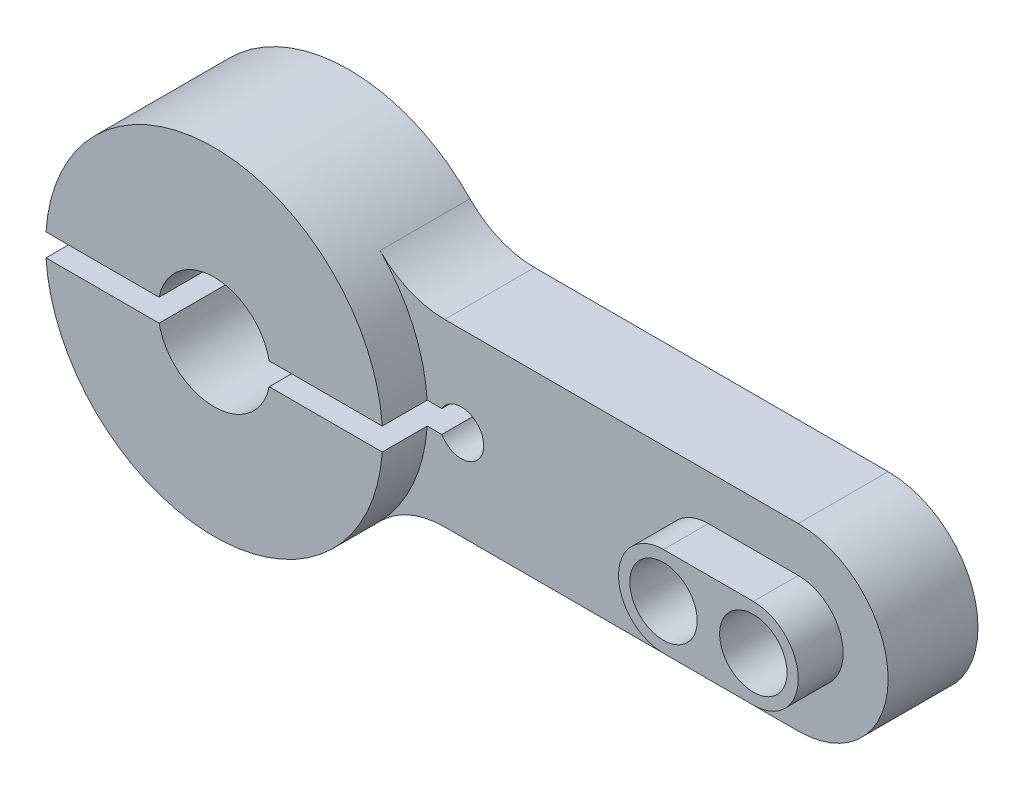
from build123d import *
from build123d.topology import SkipClean

# Parameters (mm, degrees)
BOSS_EXTRUDE1_DEPTH = 6
FILLET1_R           = 4
CUT_EXTRUDE1_DEPTH  = 2
SKETCH3_R           = 1.5
SKETCH3_R_2         = 2.5
CUT_EXTRUDE2_DEPTH  = 30.601520231
CUT_EXTRUDE3_DEPTH  = 30.601520231
BOSS_EXTRUDE2_START = -1.27
BOSS_EXTRUDE2_DEPTH = 1.27


with BuildPart() as part:
    # Sketch1 → Boss-Extrude1 (new body)
    with BuildSketch(Plane.XY):
        with BuildLine():
            Line((6.34428877, 4), (24, 4))
            ThreePointArc((24, 4), (28, 0), (24, -4))
            Line((24, -4), (6.34428877, -4))
            ThreePointArc((6.34428877, -4), (-7.5, 0), (6.34428877, 4))
        make_face()
    extrude(amount=BOSS_EXTRUDE1_DEPTH)

    # Fillet1
    fillet1_edges = [part.edges().sort_by_distance(p)[0] for p in [
        (6.34428877, 4, 3),
        (6.34428877, -4, 3),
    ]]
    fillet(fillet1_edges, radius=FILLET1_R)

    # Sketch2 → Cut-Extrude1 (cut)
    with SkipClean():  # the faces are left unmerged after this step: merging them gives an invalid solid
        with BuildSketch(Plane.XY.offset(6)):
            with BuildLine():
                Line((8.261355821, -4), (24, -4))
                ThreePointArc((24, -4), (28, 0), (24, 4))
                Line((24, 4), (8.261355821, 4))
                ThreePointArc((8.261355821, 4), (6.700976826, 4.316901116), (5.387840753, 5.217391304))
                ThreePointArc((5.387840753, 5.217391304), (7.5, 0), (5.387840753, -5.217391304))
                ThreePointArc((5.387840753, -5.217391304), (6.700976826, -4.316901116), (8.261355821, -4))
            make_face()
            with BuildLine():
                Line((20, 2), (24, 2))
                ThreePointArc((24, 2), (26, 0), (24, -2))
                Line((24, -2), (20, -2))
                ThreePointArc((20, -2), (18, 0), (20, 2))
            make_face(mode=Mode.SUBTRACT)
        extrude(amount=-CUT_EXTRUDE1_DEPTH, mode=Mode.SUBTRACT)

    # Sketch3 → Cut-Extrude2 (cut, through all)
    with SkipClean():  # the faces are left unmerged after this step: merging them gives an invalid solid
        with BuildSketch(Plane.XY.offset(6)):
            with Locations((20, 0)):
                Circle(SKETCH3_R)
            with Locations((24, 0)):
                Circle(SKETCH3_R)
            Circle(SKETCH3_R_2)
        extrude(amount=-CUT_EXTRUDE2_DEPTH, mode=Mode.SUBTRACT)

    # Sketch4 → Cut-Extrude3 (cut, through all)
    with SkipClean():  # the faces are left unmerged after this step: merging them gives an invalid solid
        with BuildSketch(Plane.XY.offset(6)):
            with BuildLine():
                Line((-8.079422864, 0.5), (8.133974596, 0.5))
                ThreePointArc((8.133974596, 0.5), (10, 0), (8.133974596, -0.5))
                Line((8.133974596, -0.5), (-8.079422864, -0.5))
                Line((-8.079422864, -0.5), (-8.079422864, 0.5))
            make_face()
        extrude(amount=-CUT_EXTRUDE3_DEPTH, mode=Mode.SUBTRACT)

    # Sketch5 → Boss-Extrude2 (add)
    with SkipClean():  # the faces are left unmerged after this step: merging them gives an invalid solid
        with BuildSketch(Plane(origin=(0, 0, 0.762), x_dir=(-1, 0, 0), z_dir=(0, 0, -1)).offset(BOSS_EXTRUDE2_START)):
            with BuildLine():
                Line((-2.449489743, 0.5), (-0.656848727, 0.5))
                ThreePointArc((-0.656848727, 0.5), (0, 0.8255), (0.656848727, 0.5))
                Line((0.656848727, 0.5), (2.449489743, 0.5))
                ThreePointArc((2.449489743, 0.5), (0, 2.5), (-2.449489743, 0.5))
            make_face()
            with BuildLine():
                Line((-2.449489743, -0.5), (-0.656848727, -0.5))
                ThreePointArc((-0.656848727, -0.5), (0, -0.8255), (0.656848727, -0.5))
                Line((0.656848727, -0.5), (2.449489743, -0.5))
                ThreePointArc((2.449489743, -0.5), (0, -2.5), (-2.449489743, -0.5))
            make_face()
        extrude(amount=BOSS_EXTRUDE2_DEPTH)


solid = part.part
